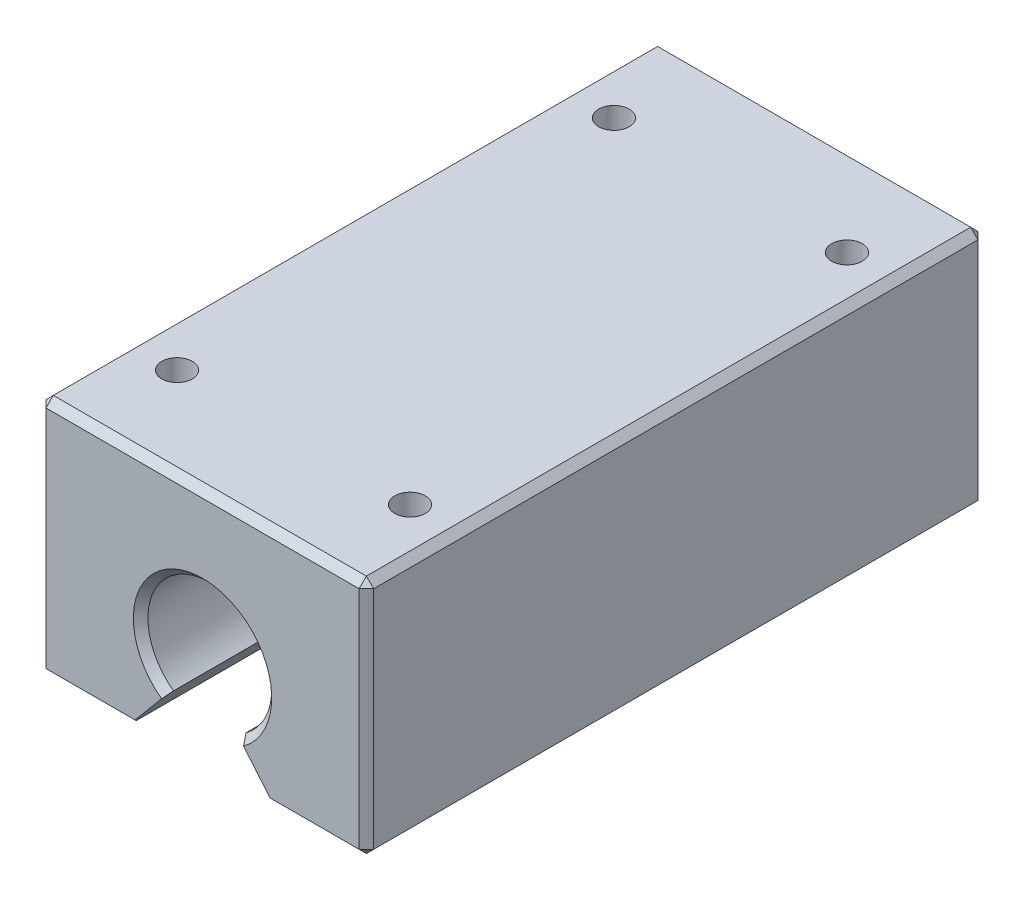
from build123d import *

# Parameters (mm, degrees)
SKETCH1_W             = 45
SKETCH1_H             = 33
EXTRUDE1_DEPTH        = 85
EXTRUDE3_DEPTH        = 90.462282555
M5_TAPPED_HOLE1_D     = 4.2
M5_TAPPED_HOLE1_DEPTH = 10
M5_TAPPED_HOLE1_TIP   = 1.2618073
CHAMFER1_SIZE         = 1


with BuildPart() as part:
    # Sketch1 → Extrude1 (new body)
    with BuildSketch(Plane.XY):
        Rectangle(SKETCH1_W, SKETCH1_H)
    extrude(amount=EXTRUDE1_DEPTH)

    # Sketch2 → Extrude3 (cut, through all)
    with BuildSketch(Plane.XY.offset(85)):
        with BuildLine():
            Line((4.983173546, -10.386071552), (0, -4.447356576))
            Line((0, -4.447356576), (-4.983173546, -10.386071552))
            ThreePointArc((-4.983173546, -10.386071552), (0, -12), (4.983173546, -10.386071552))
        make_face()
        with BuildLine():
            Line((-4.983173546, -10.386071552), (0, -4.447356576))
            Line((0, -4.447356576), (4.983173546, -10.386071552))
            ThreePointArc((4.983173546, -10.386071552), (7.569906708, -7.366071964), (8.5, -3.5))
            ThreePointArc((8.5, -3.5), (-3.866071964, 4.069906708), (-4.983173546, -10.386071552))
        make_face()
        Polygon((10.113368652, -16.5), (-10.113368652, -16.5), (-13.53955506, -20.583169961), (13.53955506, -20.583169961), align=None)
        with BuildLine():
            ThreePointArc((4.983173546, -10.386071552), (0, -12), (-4.983173546, -10.386071552))
            Line((-4.983173546, -10.386071552), (-10.113368652, -16.5))
            Line((-10.113368652, -16.5), (10.113368652, -16.5))
            Line((10.113368652, -16.5), (4.983173546, -10.386071552))
        make_face()
    extrude(amount=-EXTRUDE3_DEPTH, mode=Mode.SUBTRACT)

    # M5 Tapped Hole1
    with Locations(Plane(origin=(0, 16.5, 0), x_dir=(-1, 0, 0), z_dir=(0, 1, 0))):
        with Locations((16, 12.5), (-16, 12.5), (-16, 72.5), (16, 72.5)):
            Hole(M5_TAPPED_HOLE1_D / 2, depth=M5_TAPPED_HOLE1_DEPTH)
            with Locations((0, 0, -(M5_TAPPED_HOLE1_DEPTH + M5_TAPPED_HOLE1_TIP / 2))):  # 118° drill point
                Cone(0, M5_TAPPED_HOLE1_D / 2, M5_TAPPED_HOLE1_TIP, mode=Mode.SUBTRACT)

    # Chamfer1
    chamfer1_edges = [part.edges().sort_by_distance(p)[0] for p in [
        (-22.5, 0, 85),
        (-16.306684326, -16.5, 85),
        (16.306684326, -16.5, 0),
        (16.306684326, -16.5, 85),
        (0, 5, 85),
        (0, 5, 0),
        (22.5, 0, 85),
        (-16.306684326, -16.5, 0),
        (-22.5, 0, 0),
        (0, 16.5, 0),
        (22.5, 0, 0),
        (0, 16.5, 85),
        (22.5, -16.5, 42.5),
        (-22.5, -16.5, 42.5),
        (-22.5, 16.5, 42.5),
        (22.5, 16.5, 42.5),
    ]]
    chamfer(chamfer1_edges, length=CHAMFER1_SIZE)


solid = part.part
